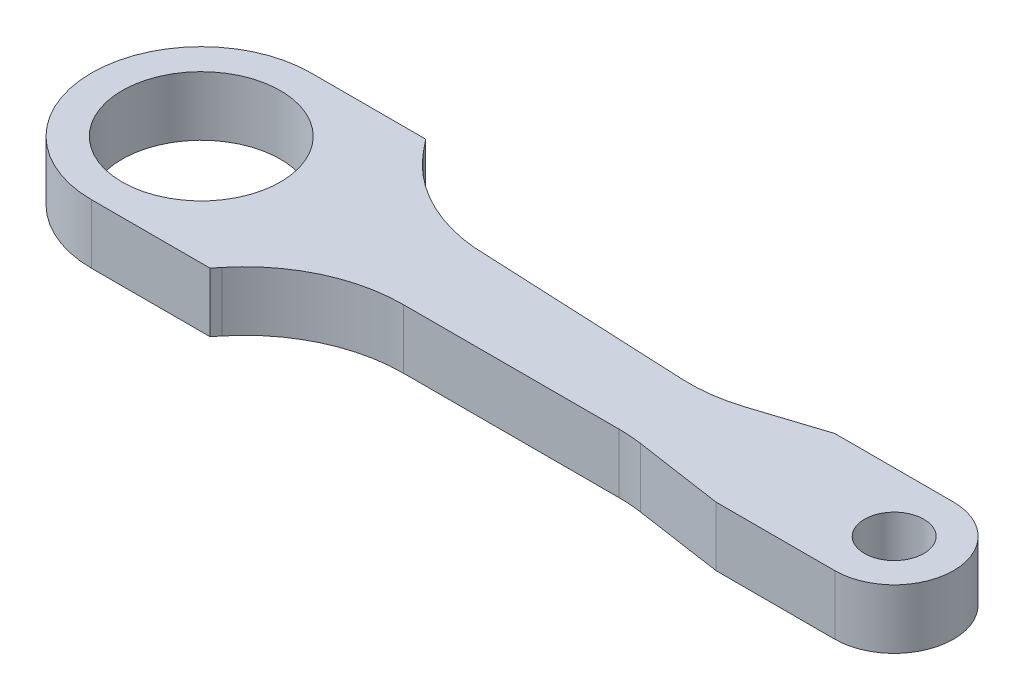
from build123d import *

# Parameters (mm, degrees)
SKETCH1_R           = 4
SKETCH1_R_2         = 1.5
BOSS_EXTRUDE1_DEPTH = 3


with BuildPart() as part:
    # Sketch1 → Boss-Extrude1 (new body)
    with BuildSketch(Plane(origin=(0, 0, 0), x_dir=(1, 0, 0), z_dir=(0, 1, 0))):
        with BuildLine():
            Line((8.116924874, 3), (4.701194702, 1.899288849))
            ThreePointArc((4.701194702, 1.899288849), (3.305590689, 1.583983301), (1.876141193, 1.522320606))
            Line((1.876141193, 1.522320606), (-8.40404093, 2))
            ThreePointArc((-8.40404093, 2), (-11.844657575, 2.777662629), (-14.616364474, 4.959460725))
            Line((-14.616364474, 4.959460725), (-15.091625453, 5.545206576))
            Line((-15.091625453, 5.545206576), (-20.883075126, 5.545206576))
            ThreePointArc((-20.883075126, 5.545206576), (-26.428281702, 0), (-20.883075126, -5.545206576))
            Line((-20.883075126, -5.545206576), (-14.895018407, -5.545206576))
            Line((-14.895018407, -5.545206576), (-14.628307755, -5.216493164))
            ThreePointArc((-14.628307755, -5.216493164), (-11.856600856, -3.034695068), (-8.415984211, -2.257032439))
            Line((-8.415984211, -2.257032439), (2.485375874, -2.257032439))
            ThreePointArc((2.485375874, -2.257032439), (3.06964146, -2.278396358), (3.650786495, -2.342374008))
            Line((3.650786495, -2.342374008), (8.116924874, -3))
            Line((8.116924874, -3), (14.116924874, -3))
            ThreePointArc((14.116924874, -3), (17.116924874, 0), (14.116924874, 3))
            Line((14.116924874, 3), (8.116924874, 3))
        make_face()
        with Locations(Location((-20.883075126, 0, 0), (0, 0, 270))):
            Circle(SKETCH1_R, mode=Mode.SUBTRACT)
        with Locations(Location((14.116924874, 0, 0), (0, 0, 270))):
            Circle(SKETCH1_R_2, mode=Mode.SUBTRACT)
    extrude(amount=BOSS_EXTRUDE1_DEPTH)


solid = part.part
